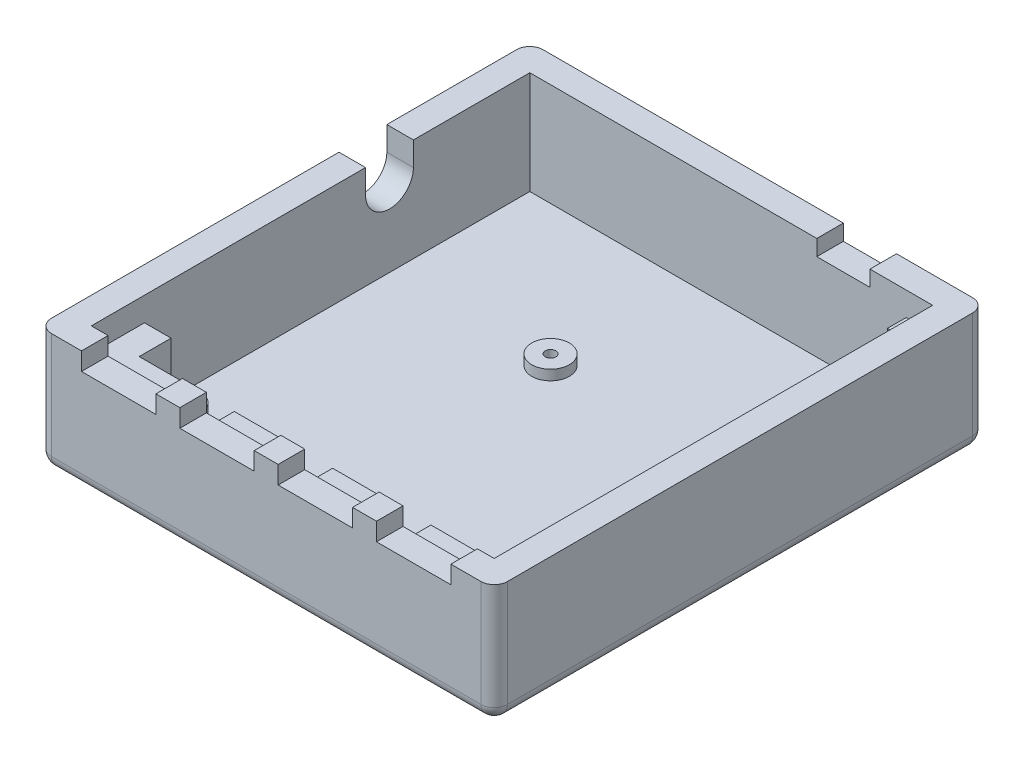
from build123d import *

# Parameters (mm, degrees)
SKETCH1_W           = 85.8
SKETCH1_H           = 92.5
BOSS_EXTRUDE1_DEPTH = 14.859
SKETCH2_W           = 85.8
SKETCH2_H           = 92.5
SKETCH2_R           = 1
BOSS_EXTRUDE2_DEPTH = 3.175
SKETCH4_W           = 85.8
SKETCH4_H           = 92.5
SKETCH4_W_2         = 75.8
SKETCH4_H_2         = 82.5
BOSS_EXTRUDE3_DEPTH = 4.5
CUT_EXTRUDE1_DEPTH  = 121.663419813
SKETCH5_W           = 14
SKETCH5_H           = 8
CUT_EXTRUDE2_DEPTH  = 121.663419813
SKETCH6_W           = 10
SKETCH6_H           = 6
CUT_EXTRUDE3_DEPTH  = 121.663419813
BOSS_EXTRUDE4_START = 1.9
SKETCH7_R           = 3.54
SKETCH7_R_2         = 1
BOSS_EXTRUDE4_DEPTH = 1.9
FILLET1_R           = 2.5
FILLET2_R           = 2.5
FILLET3_R           = 2.5
FILLET4_R           = 2.5
FILLET5_R           = 2.5


with BuildPart() as part:
    # Sketch1 → Boss-Extrude1 (new body)
    with BuildSketch(Plane(origin=(0, 0, 0), x_dir=(1, 0, 0), z_dir=(0, 1, 0))):
        with Locations((37.9, 41.25)):
            Rectangle(SKETCH1_W, SKETCH1_H)
        Polygon((5, 4), (5, 10), (0, 10), (0, 82.5), (70.8, 82.5), (70.8, 79), (75.8, 79), (75.8, 4), (59.9, 4), (59.9, 0), (52.9, 0), (52.9, 4), (41.4, 4), (41.4, 0), (34.4, 0), (34.4, 4), (22.9, 4), (22.9, 0), (15.9, 0), (15.9, 4), align=None, mode=Mode.SUBTRACT)
    extrude(amount=BOSS_EXTRUDE1_DEPTH)

    # Sketch2 → Boss-Extrude2 (add)
    with BuildSketch(Plane(origin=(0, 0, 0), x_dir=(1, 0, 0), z_dir=(0, 1, 0))):
        with Locations((37.9, 41.25)):
            Rectangle(SKETCH2_W, SKETCH2_H)
        with Locations(Location((3.5, 13.5, 0), (0, 0, 270))):
            Circle(SKETCH2_R, mode=Mode.SUBTRACT)
        with Locations(Location((19.4, 3.5, 0), (0, 0, 270))):
            Circle(SKETCH2_R, mode=Mode.SUBTRACT)
        with Locations(Location((37.9, 3.5, 0), (0, 0, 270))):
            Circle(SKETCH2_R, mode=Mode.SUBTRACT)
        with Locations(Location((56.4, 3.5, 0), (0, 0, 270))):
            Circle(SKETCH2_R, mode=Mode.SUBTRACT)
        with Locations(Location((30.3, 56.1, 0), (0, 0, 270))):
            Circle(SKETCH2_R, mode=Mode.SUBTRACT)
        with Locations(Location((71.8, 75.5, 0), (0, 0, 270))):
            Circle(SKETCH2_R, mode=Mode.SUBTRACT)
    extrude(amount=-BOSS_EXTRUDE2_DEPTH)

    # Sketch4 → Boss-Extrude3 (add)
    with BuildSketch(Plane(origin=(0, 14.859, 0), x_dir=(1, 0, 0), z_dir=(0, 1, 0))):
        with Locations((37.9, 41.25)):
            Rectangle(SKETCH4_W, SKETCH4_H)
        with Locations((37.9, 41.25)):
            Rectangle(SKETCH4_W_2, SKETCH4_H_2, mode=Mode.SUBTRACT)
    extrude(amount=BOSS_EXTRUDE3_DEPTH)

    # Sketch3 → Cut-Extrude1 (cut, through all)
    with BuildSketch(Plane(origin=(0, 0, 0), x_dir=(0, 0, -1), z_dir=(1, 0, 0))):
        with BuildLine():
            Line((60.6, 14.859), (60.6, 19.359))
            Line((60.6, 19.359), (51.6, 19.359))
            Line((51.6, 19.359), (51.6, 14.859))
            ThreePointArc((51.6, 14.859), (56.1, 10.359), (60.6, 14.859))
        make_face()
    extrude(amount=-CUT_EXTRUDE1_DEPTH, mode=Mode.SUBTRACT)

    # Sketch5 → Cut-Extrude2 (cut, through all)
    with BuildSketch(Plane.XY):
        with Locations((10.15, 20)):
            Rectangle(SKETCH5_W, SKETCH5_H)
        with Locations((28.65, 20)):
            Rectangle(SKETCH5_W, SKETCH5_H)
        with Locations((47.15, 20)):
            Rectangle(SKETCH5_W, SKETCH5_H)
        with Locations((65.65, 20)):
            Rectangle(SKETCH5_W, SKETCH5_H)
    extrude(amount=CUT_EXTRUDE2_DEPTH, mode=Mode.SUBTRACT)

    # Sketch6 → Cut-Extrude3 (cut, through all)
    with BuildSketch(Plane.XY):
        with Locations((59, 19.383)):
            Rectangle(SKETCH6_W, SKETCH6_H)
    extrude(amount=-CUT_EXTRUDE3_DEPTH, mode=Mode.SUBTRACT)

    # Sketch7 → Boss-Extrude4 (add)
    # profile 1 of 6: a face of its own
    with BuildSketch(Plane(origin=(0, 0, 0), x_dir=(1, 0, 0), z_dir=(0, 1, 0)).offset(BOSS_EXTRUDE4_START)):
        with Locations(Location((30.3, 56.1, 0), (0, 0, 90))):
            Circle(SKETCH7_R)
        with Locations(Location((30.3, 56.1, 0), (0, 0, 270))):
            Circle(SKETCH7_R_2, mode=Mode.SUBTRACT)
    # profile 2 of 6: a face of its own
    with BuildSketch(Plane(origin=(0, 0, 0), x_dir=(1, 0, 0), z_dir=(0, 1, 0)).offset(BOSS_EXTRUDE4_START)):
        with BuildLine():
            Line((0, 13.5), (0, 10))
            Line((0, 10), (3.5, 10))
            ThreePointArc((3.5, 10), (5.974873734, 15.974873734), (0, 13.5))
        make_face()
        with Locations(Location((3.5, 13.5, 0), (0, 0, 270))):
            Circle(SKETCH7_R_2, mode=Mode.SUBTRACT)
    # profile 3 of 6: a face of its own
    with BuildSketch(Plane(origin=(0, 0, 0), x_dir=(1, 0, 0), z_dir=(0, 1, 0)).offset(BOSS_EXTRUDE4_START)):
        with BuildLine():
            Line((15.9, 3.5), (15.9, 0))
            Line((15.9, 0), (22.9, 0))
            Line((22.9, 0), (22.9, 3.5))
            ThreePointArc((22.9, 3.5), (19.4, 7), (15.9, 3.5))
        make_face()
        with Locations(Location((19.4, 3.5, 0), (0, 0, 270))):
            Circle(SKETCH7_R_2, mode=Mode.SUBTRACT)
    # profile 4 of 6: a face of its own
    with BuildSketch(Plane(origin=(0, 0, 0), x_dir=(1, 0, 0), z_dir=(0, 1, 0)).offset(BOSS_EXTRUDE4_START)):
        with BuildLine():
            Line((34.4, 3.5), (34.4, 0))
            Line((34.4, 0), (41.4, 0))
            Line((41.4, 0), (41.4, 3.5))
            ThreePointArc((41.4, 3.5), (37.9, 7), (34.4, 3.5))
        make_face()
        with Locations(Location((37.9, 3.5, 0), (0, 0, 270))):
            Circle(SKETCH7_R_2, mode=Mode.SUBTRACT)
    # profile 5 of 6: a face of its own
    with BuildSketch(Plane(origin=(0, 0, 0), x_dir=(1, 0, 0), z_dir=(0, 1, 0)).offset(BOSS_EXTRUDE4_START)):
        with BuildLine():
            Line((52.9, 3.5), (52.9, 0))
            Line((52.9, 0), (59.9, 0))
            Line((59.9, 0), (59.9, 3.5))
            ThreePointArc((59.9, 3.5), (56.4, 7), (52.9, 3.5))
        make_face()
        with Locations(Location((56.4, 3.5, 0), (0, 0, 270))):
            Circle(SKETCH7_R_2, mode=Mode.SUBTRACT)
    # profile 6 of 6: a face of its own
    with BuildSketch(Plane(origin=(0, 0, 0), x_dir=(1, 0, 0), z_dir=(0, 1, 0)).offset(BOSS_EXTRUDE4_START)):
        with BuildLine():
            Line((75.8, 79), (69.863508327, 79))
            ThreePointArc((69.863508327, 79), (69.768493994, 72.054280431), (75.8, 75.5))
            Line((75.8, 75.5), (75.8, 79))
        make_face()
        with Locations(Location((71.8, 75.5, 0), (0, 0, 270))):
            Circle(SKETCH7_R_2, mode=Mode.SUBTRACT)
    extrude(amount=-BOSS_EXTRUDE4_DEPTH)

    # Fillet1
    fillet1_edges = [part.edges().sort_by_distance(p)[0] for p in [
        (-5, 8.092, 5),
    ]]
    fillet(fillet1_edges, radius=FILLET1_R)

    # Fillet2
    fillet2_edges = [part.edges().sort_by_distance(p)[0] for p in [
        (80.8, 8.092, 5),
    ]]
    fillet(fillet2_edges, radius=FILLET2_R)

    # Fillet3
    fillet3_edges = [part.edges().sort_by_distance(p)[0] for p in [
        (80.8, 8.092, -87.5),
    ]]
    fillet(fillet3_edges, radius=FILLET3_R)

    # Fillet4
    fillet4_edges = [part.edges().sort_by_distance(p)[0] for p in [
        (-5, 8.092, -87.5),
    ]]
    fillet(fillet4_edges, radius=FILLET4_R)

    # Fillet5
    fillet5_edges = [part.edges().sort_by_distance(p)[0] for p in [
        (37.9, -3.175, 5),
        (-4.267766953, -3.175, 4.267766953),
        (80.8, -3.175, -41.25),
        (80.067766953, -3.175, 4.267766953),
        (37.9, -3.175, -87.5),
        (80.067766953, -3.175, -86.767766953),
        (-5, -3.175, -41.25),
        (-4.267766953, -3.175, -86.767766953),
    ]]
    fillet(fillet5_edges, radius=FILLET5_R)


solid = part.part
